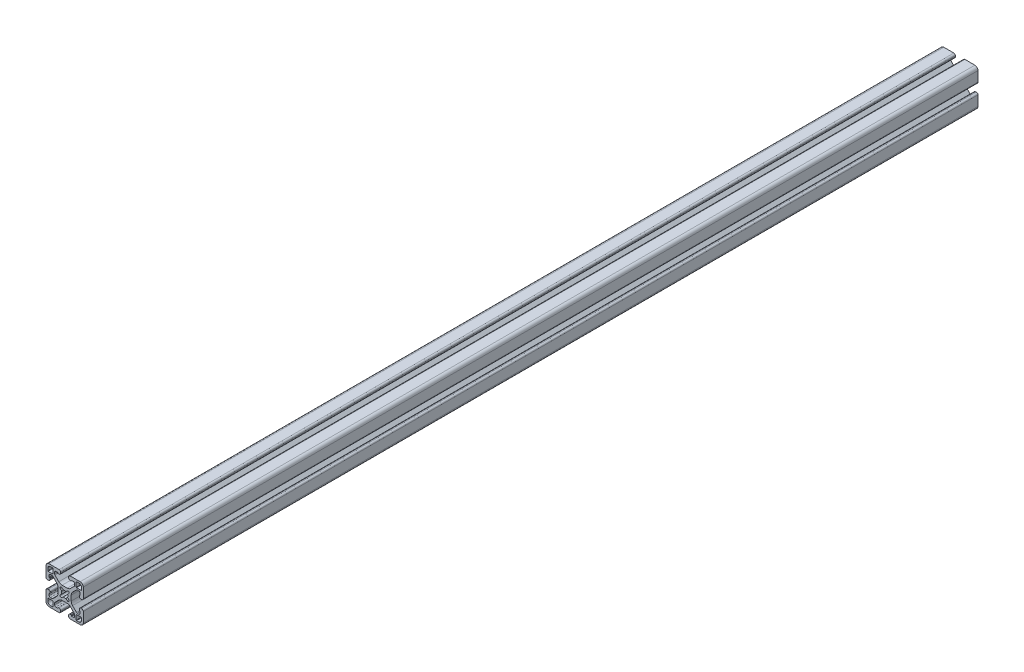
from build123d import *

# Parameters (mm, degrees)
EXTRUDE1_DEPTH = 914.4


with BuildPart() as part:
    # Sketch1 → Extrude1 (new body)
    with BuildSketch(Plane.XY):
        with BuildLine():
            Line((-46.536752228, -7.000622168), (-46.536752228, -8.774580164))
            ThreePointArc((-46.536752228, -8.774580164), (-46.907290083, -9.675221514), (-47.806745776, -10.048628264))
            Line((-47.806745776, -10.048628264), (-49.392633083, -10.048628264))
            ThreePointArc((-49.392633083, -10.048628264), (-49.878641042, -9.95195527), (-50.290658695, -9.676653876))
            Line((-50.290658695, -9.676653876), (-54.238761565, -5.728551005))
            ThreePointArc((-54.238761565, -5.728551005), (-55.26838878, -4.187604983), (-55.629945776, -2.369935216))
            Line((-55.629945776, -2.369935216), (-55.629945776, 2.846678689))
            ThreePointArc((-55.629945776, 2.846678689), (-55.26838878, 4.664348456), (-54.238761565, 6.205294478))
            Line((-54.238761565, 6.205294478), (-50.290658695, 10.153397348))
            ThreePointArc((-50.290658695, 10.153397348), (-49.878641042, 10.428698742), (-49.392633083, 10.525371736))
            Line((-49.392633083, 10.525371736), (-47.806745776, 10.525371736))
            ThreePointArc((-47.806745776, 10.525371736), (-46.907290079, 10.151964982), (-46.536752228, 9.251323623))
            Line((-46.536752228, 9.251323623), (-46.536752228, 7.47736564))
            ThreePointArc((-46.536752228, 7.47736564), (-46.648344767, 7.207957418), (-46.91775299, 7.096364878))
            Line((-46.91775299, 7.096364878), (-46.993953142, 7.096364878))
            ThreePointArc((-46.993953142, 7.096364878), (-47.263362671, 6.984771032), (-47.374953904, 6.715360422))
            Line((-47.374953904, 6.715360422), (-47.374945776, 5.877156465))
            ThreePointArc((-47.374945776, 5.877156465), (-46.913692136, 4.763614578), (-45.800145776, 4.302371736))
            Line((-45.800145776, 4.302371736), (-44.885745776, 4.302371736))
            ThreePointArc((-44.885745776, 4.302371736), (-43.772194017, 4.763619977), (-43.310945776, 5.877171736))
            Line((-43.310945776, 5.877171736), (-43.310945776, 16.113371736))
            ThreePointArc((-43.310945776, 16.113371736), (-44.240881746, 18.358435766), (-46.485945776, 19.288371736))
            Line((-46.485945776, 19.288371736), (-56.722145776, 19.288371736))
            ThreePointArc((-56.722145776, 19.288371736), (-57.835697535, 18.827123495), (-58.296945776, 17.713571736))
            Line((-58.296945776, 17.713571736), (-58.296945776, 16.799171736))
            ThreePointArc((-58.296945776, 16.799171736), (-57.835702934, 15.685625376), (-56.722161047, 15.224371736))
            Line((-56.722161047, 15.224371736), (-55.883957091, 15.224363608))
            ThreePointArc((-55.883957091, 15.224363608), (-55.61454648, 15.335954841), (-55.502952634, 15.60536437))
            Line((-55.502952634, 15.60536437), (-55.502952634, 15.681564523))
            ThreePointArc((-55.502952634, 15.681564523), (-55.391360095, 15.950972745), (-55.121951872, 16.062565285))
            Line((-55.121951872, 16.062565285), (-53.347993876, 16.062565285))
            ThreePointArc((-53.347993876, 16.062565285), (-52.447352526, 15.692027429), (-52.073945776, 14.792571736))
            Line((-52.073945776, 14.792571736), (-52.073945776, 13.206684429))
            ThreePointArc((-52.073945776, 13.206684429), (-52.17061877, 12.72067647), (-52.445920164, 12.308658817))
            Line((-52.445920164, 12.308658817), (-56.394023034, 8.360555947))
            ThreePointArc((-56.394023034, 8.360555947), (-57.934969057, 7.330928733), (-59.752638824, 6.969371736))
            Line((-59.752638824, 6.969371736), (-64.969252728, 6.969371736))
            ThreePointArc((-64.969252728, 6.969371736), (-66.786922496, 7.330928733), (-68.327868518, 8.360555947))
            Line((-68.327868518, 8.360555947), (-72.275971388, 12.308658817))
            ThreePointArc((-72.275971388, 12.308658817), (-72.551272782, 12.72067647), (-72.647945776, 13.206684429))
            Line((-72.647945776, 13.206684429), (-72.647945776, 14.792571736))
            ThreePointArc((-72.647945776, 14.792571736), (-72.274539022, 15.692027434), (-71.373897663, 16.062565285))
            Line((-71.373897663, 16.062565285), (-69.59993968, 16.062565285))
            ThreePointArc((-69.59993968, 16.062565285), (-69.330531458, 15.950972745), (-69.218938918, 15.681564523))
            Line((-69.218938918, 15.681564523), (-69.218938918, 15.60536437))
            ThreePointArc((-69.218938918, 15.60536437), (-69.107345072, 15.335954841), (-68.837934461, 15.224363608))
            Line((-68.837934461, 15.224363608), (-67.999730505, 15.224371736))
            ThreePointArc((-67.999730505, 15.224371736), (-66.886188618, 15.685625376), (-66.424945776, 16.799171736))
            Line((-66.424945776, 16.799171736), (-66.424945776, 17.713571736))
            ThreePointArc((-66.424945776, 17.713571736), (-66.886194017, 18.827123495), (-67.999745776, 19.288371736))
            Line((-67.999745776, 19.288371736), (-78.235945776, 19.288371736))
            ThreePointArc((-78.235945776, 19.288371736), (-80.481009806, 18.358435766), (-81.410945776, 16.113371736))
            Line((-81.410945776, 16.113371736), (-81.410945776, 5.877171736))
            ThreePointArc((-81.410945776, 5.877171736), (-80.949697535, 4.763619977), (-79.836145776, 4.302371736))
            Line((-79.836145776, 4.302371736), (-78.921745776, 4.302371736))
            ThreePointArc((-78.921745776, 4.302371736), (-77.808199416, 4.763614578), (-77.346945776, 5.877156465))
            Line((-77.346945776, 5.877156465), (-77.346937648, 6.715360422))
            ThreePointArc((-77.346937648, 6.715360422), (-77.458528881, 6.984771032), (-77.72793841, 7.096364878))
            Line((-77.72793841, 7.096364878), (-77.804138562, 7.096364878))
            ThreePointArc((-77.804138562, 7.096364878), (-78.073546785, 7.207957418), (-78.185139324, 7.47736564))
            Line((-78.185139324, 7.47736564), (-78.185139324, 9.251323637))
            ThreePointArc((-78.185139324, 9.251323637), (-77.814601469, 10.151964987), (-76.915145776, 10.525371736))
            Line((-76.915145776, 10.525371736), (-75.329258469, 10.525371736))
            ThreePointArc((-75.329258469, 10.525371736), (-74.84325051, 10.428698742), (-74.431232857, 10.153397348))
            Line((-74.431232857, 10.153397348), (-70.483129987, 6.205294478))
            ThreePointArc((-70.483129987, 6.205294478), (-69.453502773, 4.664348456), (-69.091945776, 2.846678689))
            Line((-69.091945776, 2.846678689), (-69.091945776, -2.369935216))
            ThreePointArc((-69.091945776, -2.369935216), (-69.453502773, -4.187604983), (-70.483129987, -5.728551005))
            Line((-70.483129987, -5.728551005), (-74.431232857, -9.676653876))
            ThreePointArc((-74.431232857, -9.676653876), (-74.84325051, -9.95195527), (-75.329258469, -10.048628264))
            Line((-75.329258469, -10.048628264), (-76.915145776, -10.048628264))
            ThreePointArc((-76.915145776, -10.048628264), (-77.814601474, -9.67522151), (-78.185139324, -8.774580151))
            Line((-78.185139324, -8.774580151), (-78.185139324, -7.000622168))
            ThreePointArc((-78.185139324, -7.000622168), (-78.073546785, -6.731213945), (-77.804138562, -6.619621406))
            Line((-77.804138562, -6.619621406), (-77.72793841, -6.619621406))
            ThreePointArc((-77.72793841, -6.619621406), (-77.458528881, -6.50802756), (-77.346937648, -6.238616949))
            Line((-77.346937648, -6.238616949), (-77.346945776, -5.400412993))
            ThreePointArc((-77.346945776, -5.400412993), (-77.808199416, -4.286871106), (-78.921745776, -3.825628264))
            Line((-78.921745776, -3.825628264), (-79.836145776, -3.825628264))
            ThreePointArc((-79.836145776, -3.825628264), (-80.949697535, -4.286876505), (-81.410945776, -5.400428264))
            Line((-81.410945776, -5.400428264), (-81.410945776, -15.636628264))
            ThreePointArc((-81.410945776, -15.636628264), (-80.481009806, -17.881692294), (-78.235945776, -18.811628264))
            Line((-78.235945776, -18.811628264), (-67.999745776, -18.811628264))
            ThreePointArc((-67.999745776, -18.811628264), (-66.886194017, -18.350380023), (-66.424945776, -17.236828264))
            Line((-66.424945776, -17.236828264), (-66.424945776, -16.322428264))
            ThreePointArc((-66.424945776, -16.322428264), (-66.886188618, -15.208881904), (-67.999730505, -14.747628264))
            Line((-67.999730505, -14.747628264), (-68.837934461, -14.747620136))
            ThreePointArc((-68.837934461, -14.747620136), (-69.107345072, -14.859211369), (-69.218938918, -15.128620898))
            Line((-69.218938918, -15.128620898), (-69.218938918, -15.20482105))
            ThreePointArc((-69.218938918, -15.20482105), (-69.330531458, -15.474229273), (-69.59993968, -15.585821812))
            Line((-69.59993968, -15.585821812), (-71.373897676, -15.585821812))
            ThreePointArc((-71.373897676, -15.585821812), (-72.274539027, -15.215283957), (-72.647945776, -14.315828264))
            Line((-72.647945776, -14.315828264), (-72.647945776, -12.729940957))
            ThreePointArc((-72.647945776, -12.729940957), (-72.551272782, -12.243932998), (-72.275971388, -11.831915345))
            Line((-72.275971388, -11.831915345), (-68.327868518, -7.883812475))
            ThreePointArc((-68.327868518, -7.883812475), (-66.786922496, -6.85418526), (-64.969252728, -6.492628264))
            Line((-64.969252728, -6.492628264), (-59.752638824, -6.492628264))
            ThreePointArc((-59.752638824, -6.492628264), (-57.934969057, -6.85418526), (-56.394023034, -7.883812475))
            Line((-56.394023034, -7.883812475), (-52.445920164, -11.831915345))
            ThreePointArc((-52.445920164, -11.831915345), (-52.17061877, -12.243932998), (-52.073945776, -12.729940957))
            Line((-52.073945776, -12.729940957), (-52.073945776, -14.315828264))
            ThreePointArc((-52.073945776, -14.315828264), (-52.44735253, -15.215283961), (-53.347993889, -15.585821812))
            Line((-53.347993889, -15.585821812), (-55.121951872, -15.585821812))
            ThreePointArc((-55.121951872, -15.585821812), (-55.391360095, -15.474229273), (-55.502952634, -15.20482105))
            Line((-55.502952634, -15.20482105), (-55.502952634, -15.128620898))
            ThreePointArc((-55.502952634, -15.128620898), (-55.61454648, -14.859211369), (-55.883957091, -14.747620136))
            Line((-55.883957091, -14.747620136), (-56.722161047, -14.747628264))
            ThreePointArc((-56.722161047, -14.747628264), (-57.835702934, -15.208881904), (-58.296945776, -16.322428264))
            Line((-58.296945776, -16.322428264), (-58.296945776, -17.236828264))
            ThreePointArc((-58.296945776, -17.236828264), (-57.835697535, -18.350380023), (-56.722145776, -18.811628264))
            Line((-56.722145776, -18.811628264), (-46.485945776, -18.811628264))
            ThreePointArc((-46.485945776, -18.811628264), (-44.240881746, -17.881692294), (-43.310945776, -15.636628264))
            Line((-43.310945776, -15.636628264), (-43.310945776, -5.400428264))
            ThreePointArc((-43.310945776, -5.400428264), (-43.772194017, -4.286876505), (-44.885745776, -3.825628264))
            Line((-44.885745776, -3.825628264), (-45.800145776, -3.825628264))
            ThreePointArc((-45.800145776, -3.825628264), (-46.913692136, -4.286871106), (-47.374945776, -5.400412993))
            Line((-47.374945776, -5.400412993), (-47.374953904, -6.238616949))
            ThreePointArc((-47.374953904, -6.238616949), (-47.263362671, -6.50802756), (-46.993953142, -6.619621406))
            Line((-46.993953142, -6.619621406), (-46.91775299, -6.619621406))
            ThreePointArc((-46.91775299, -6.619621406), (-46.648344767, -6.731213945), (-46.536752228, -7.000622168))
        make_face()
        with BuildLine():
            Line((-66.704246649, -2.488483035), (-65.333825803, -1.118062189))
            ThreePointArc((-65.333825803, -1.118062189), (-65.628655776, 0.238371736), (-65.333825803, 1.594805661))
            Line((-65.333825803, 1.594805661), (-66.704246649, 2.965226507))
            ThreePointArc((-66.704246649, 2.965226507), (-66.704246649, 4.581672609), (-65.087800547, 4.581672609))
            Line((-65.087800547, 4.581672609), (-63.717379701, 3.211251763))
            ThreePointArc((-63.717379701, 3.211251763), (-62.360945776, 3.506081736), (-61.004511851, 3.211251763))
            Line((-61.004511851, 3.211251763), (-59.721184579, 4.483982556))
            ThreePointArc((-59.721184579, 4.483982556), (-58.017644903, 4.581672609), (-58.115334956, 2.878132934))
            Line((-58.115334956, 2.878132934), (-59.38806575, 1.594805661))
            ThreePointArc((-59.38806575, 1.594805661), (-59.093235776, 0.238371736), (-59.38806575, -1.118062189))
            Line((-59.38806575, -1.118062189), (-58.017644903, -2.488483035))
            ThreePointArc((-58.017644903, -2.488483035), (-58.017644903, -4.104929137), (-59.634091005, -4.104929137))
            Line((-59.634091005, -4.104929137), (-61.004511851, -2.73450829))
            ThreePointArc((-61.004511851, -2.73450829), (-62.360945776, -3.029338264), (-63.717379701, -2.73450829))
            Line((-63.717379701, -2.73450829), (-65.087800547, -4.104929137))
            ThreePointArc((-65.087800547, -4.104929137), (-66.704246649, -4.104929137), (-66.704246649, -2.488483035))
        make_face(mode=Mode.SUBTRACT)
        with BuildLine():
            Line((-79.607545776, 12.481171736), (-79.607545776, 14.690971736))
            ThreePointArc((-79.607545776, 14.690971736), (-78.789202123, 16.666628083), (-76.813545776, 17.484971736))
            Line((-76.813545776, 17.484971736), (-74.603745776, 17.484971736))
            ThreePointArc((-74.603745776, 17.484971736), (-74.334338092, 17.37337942), (-74.222745776, 17.103971736))
            Line((-74.222745776, 17.103971736), (-74.222745776, 12.481171736))
            ThreePointArc((-74.222745776, 12.481171736), (-74.334338092, 12.211764053), (-74.603745776, 12.100171736))
            Line((-74.603745776, 12.100171736), (-79.226545776, 12.100171736))
            ThreePointArc((-79.226545776, 12.100171736), (-79.49595346, 12.211764053), (-79.607545776, 12.481171736))
        make_face(mode=Mode.SUBTRACT)
        with BuildLine():
            Line((-74.603745776, -17.008228264), (-76.813545776, -17.008228264))
            ThreePointArc((-76.813545776, -17.008228264), (-78.789202123, -16.18988461), (-79.607545776, -14.214228264))
            Line((-79.607545776, -14.214228264), (-79.607545776, -12.004428264))
            ThreePointArc((-79.607545776, -12.004428264), (-79.49595346, -11.73502058), (-79.226545776, -11.623428264))
            Line((-79.226545776, -11.623428264), (-74.603745776, -11.623428264))
            ThreePointArc((-74.603745776, -11.623428264), (-74.334338092, -11.73502058), (-74.222745776, -12.004428264))
            Line((-74.222745776, -12.004428264), (-74.222745776, -16.627228264))
            ThreePointArc((-74.222745776, -16.627228264), (-74.334338092, -16.896635947), (-74.603745776, -17.008228264))
        make_face(mode=Mode.SUBTRACT)
        with BuildLine():
            Line((-45.114345776, -12.004428264), (-45.114345776, -14.214228264))
            ThreePointArc((-45.114345776, -14.214228264), (-45.932689429, -16.18988461), (-47.908345776, -17.008228264))
            Line((-47.908345776, -17.008228264), (-50.118145776, -17.008228264))
            ThreePointArc((-50.118145776, -17.008228264), (-50.38755346, -16.896635947), (-50.499145776, -16.627228264))
            Line((-50.499145776, -16.627228264), (-50.499145776, -12.004428264))
            ThreePointArc((-50.499145776, -12.004428264), (-50.38755346, -11.73502058), (-50.118145776, -11.623428264))
            Line((-50.118145776, -11.623428264), (-45.495345776, -11.623428264))
            ThreePointArc((-45.495345776, -11.623428264), (-45.225938092, -11.73502058), (-45.114345776, -12.004428264))
        make_face(mode=Mode.SUBTRACT)
        with BuildLine():
            Line((-50.118145776, 17.484971736), (-47.908345776, 17.484971736))
            ThreePointArc((-47.908345776, 17.484971736), (-45.932689429, 16.666628083), (-45.114345776, 14.690971736))
            Line((-45.114345776, 14.690971736), (-45.114345776, 12.481171736))
            ThreePointArc((-45.114345776, 12.481171736), (-45.225938092, 12.211764053), (-45.495345776, 12.100171736))
            Line((-45.495345776, 12.100171736), (-50.118145776, 12.100171736))
            ThreePointArc((-50.118145776, 12.100171736), (-50.38755346, 12.211764053), (-50.499145776, 12.481171736))
            Line((-50.499145776, 12.481171736), (-50.499145776, 17.103971736))
            ThreePointArc((-50.499145776, 17.103971736), (-50.38755346, 17.37337942), (-50.118145776, 17.484971736))
        make_face(mode=Mode.SUBTRACT)
    extrude(amount=-EXTRUDE1_DEPTH)


solid = part.part
